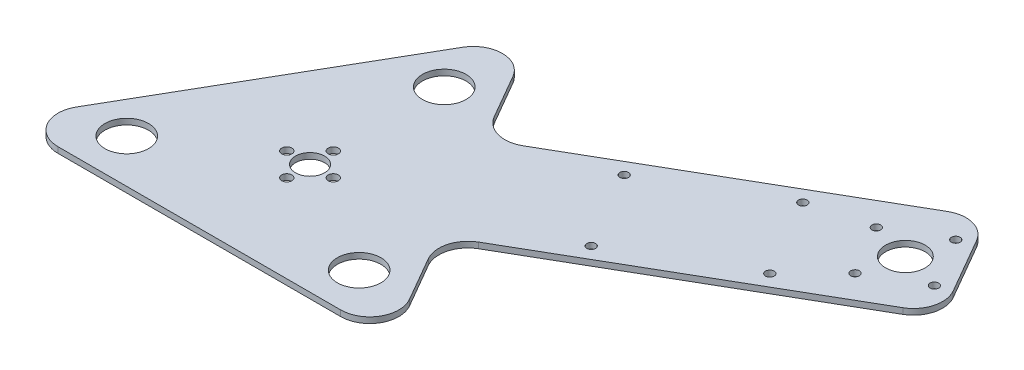
from build123d import *

# Parameters (mm, degrees)
SKETCH1_R           = 7.5
SKETCH1_R_2         = 5
BOSS_EXTRUDE1_DEPTH = 2
BOSS_EXTRUDE2_DEPTH = 2
FILLET1_R           = 10
SKETCH3_R           = 6.8
CUT_EXTRUDE1_DEPTH  = 10
SKETCH4_R           = 1.5
CUT_EXTRUDE2_DEPTH  = 10
SKETCH5_R           = 1.5
CUT_EXTRUDE3_DEPTH  = 10
SKETCH6_R           = 1.75
CUT_EXTRUDE4_DEPTH  = 179.433043373


with BuildPart() as part:
    # Sketch1 → Boss-Extrude1 (new body)
    with BuildSketch(Plane(origin=(0, 0, 0), x_dir=(1, 0, 0), z_dir=(0, 1, 0))):
        Polygon((0, 76.188021535), (-65.980762114, -38.094010768), (65.980762114, -38.094010768), align=None)
        with Locations(Location((0, 46.188021535, 0), (0, 0, 270))):
            Circle(SKETCH1_R, mode=Mode.SUBTRACT)
        with Locations(Location((-40, -23.094010768, 0), (0, 0, 270))):
            Circle(SKETCH1_R, mode=Mode.SUBTRACT)
        with Locations(Location((40, -23.094010768, 0), (0, 0, 270))):
            Circle(SKETCH1_R, mode=Mode.SUBTRACT)
        with Locations(Location((0, 0, 0), (0, 0, 270))):
            Circle(SKETCH1_R_2, mode=Mode.SUBTRACT)
    extrude(amount=BOSS_EXTRUDE1_DEPTH)

    # Sketch2 → Boss-Extrude2 (add)
    with BuildSketch(Plane(origin=(0, 2, 0), x_dir=(1, 0, 0), z_dir=(0, 1, 0))):
        Polygon((43.490381057, 0.860471904), (22.490381057, 37.233538863), (132.394191624, 100.686533479), (153.394191624, 64.313466521), align=None)
    extrude(amount=-BOSS_EXTRUDE2_DEPTH)

    # Fillet1
    fillet1_edges = [part.edges().sort_by_distance(p)[0] for p in [
        (153.394191624, 1, -64.313466521),
        (43.490381057, 1, -0.860471904),
        (22.490381057, 1, -37.233538863),
        (132.394191624, 1, -100.686533479),
        (65.980762114, 1, 38.094010768),
        (-65.980762114, 1, 38.094010768),
        (0, 1, -76.188021535),
    ]]
    fillet(fillet1_edges, radius=FILLET1_R)

    # Sketch3 → Cut-Extrude1 (cut)
    with BuildSketch(Plane(origin=(0, 2, 0), x_dir=(1, 0, 0), z_dir=(0, 1, 0))):
        with Locations(Location((129.903810568, 75, 0), (0, 0, 270))):
            Circle(SKETCH3_R)
    extrude(amount=-CUT_EXTRUDE1_DEPTH, mode=Mode.SUBTRACT)

    # Sketch4 → Cut-Extrude2 (cut)
    with BuildSketch(Plane(origin=(0, 2, 0), x_dir=(1, 0, 0), z_dir=(0, 1, 0))):
        with Locations(Location((133.564064606, 88.660254038, 0), (0, 0, 270))):
            Circle(SKETCH4_R)
        with Locations(Location((116.24355653, 78.660254038, 0), (0, 0, 270))):
            Circle(SKETCH4_R)
        with Locations(Location((126.24355653, 61.339745962, 0), (0, 0, 270))):
            Circle(SKETCH4_R)
        with Locations(Location((143.564064606, 71.339745962, 0), (0, 0, 270))):
            Circle(SKETCH4_R)
    extrude(amount=-CUT_EXTRUDE2_DEPTH, mode=Mode.SUBTRACT)

    # Sketch5 → Cut-Extrude3 (cut)
    with BuildSketch(Plane(origin=(0, 2, 0), x_dir=(1, 0, 0), z_dir=(0, 1, 0))):
        with Locations(Location((96.173048454, 73.423393759, 0), (0, 0, 270))):
            Circle(SKETCH5_R)
        with Locations(Location((57.201905284, 50.923393759, 0), (0, 0, 270))):
            Circle(SKETCH5_R)
        with Locations(Location((111.673048454, 46.576606241, 0), (0, 0, 270))):
            Circle(SKETCH5_R)
        with Locations(Location((72.701905284, 24.076606241, 0), (0, 0, 270))):
            Circle(SKETCH5_R)
    extrude(amount=-CUT_EXTRUDE3_DEPTH, mode=Mode.SUBTRACT)

    # Sketch6 → Cut-Extrude4 (cut, through all)
    with BuildSketch(Plane(origin=(0, 2, 0), x_dir=(1, 0, 0), z_dir=(0, 1, 0))):
        with Locations(Location((0, 8, 0), (0, 0, 270))):
            Circle(SKETCH6_R)
        with Locations(Location((8, 0, 0), (0, 0, 270))):
            Circle(SKETCH6_R)
        with Locations(Location((0, -8, 0), (0, 0, 270))):
            Circle(SKETCH6_R)
        with Locations(Location((-8, 0, 0), (0, 0, 270))):
            Circle(SKETCH6_R)
    extrude(amount=-CUT_EXTRUDE4_DEPTH, mode=Mode.SUBTRACT)


solid = part.part
